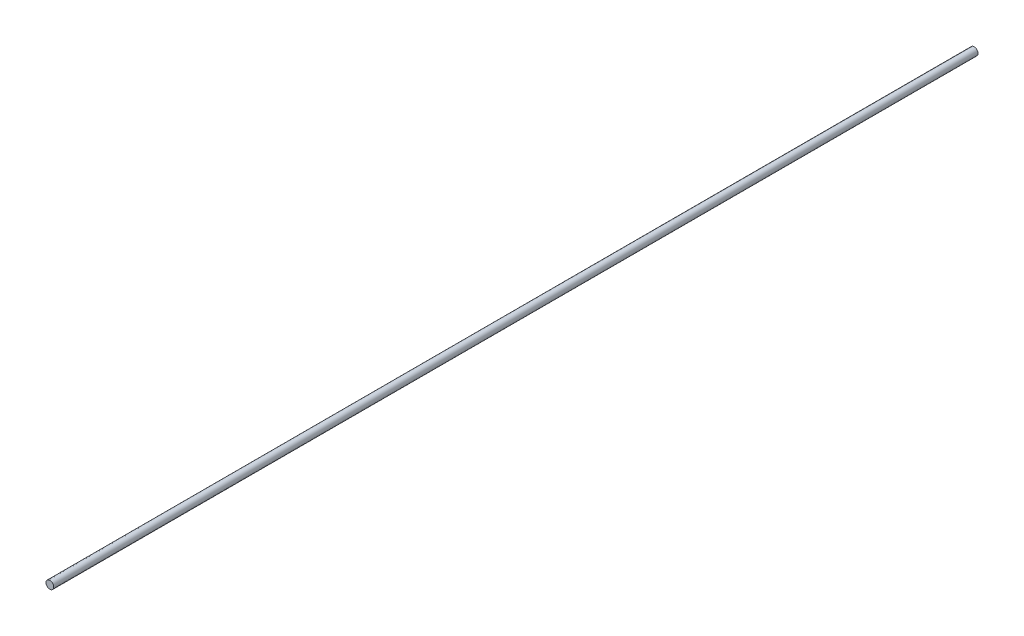
from build123d import *

# Parameters (mm, degrees)
SKETCH1_R           = 4
BOSS_EXTRUDE1_DEPTH = 960


with BuildPart() as part:
    # Sketch1 → Boss-Extrude1 (new body)
    with BuildSketch(Plane.XY):
        Circle(SKETCH1_R)
    extrude(amount=BOSS_EXTRUDE1_DEPTH)


solid = part.part
